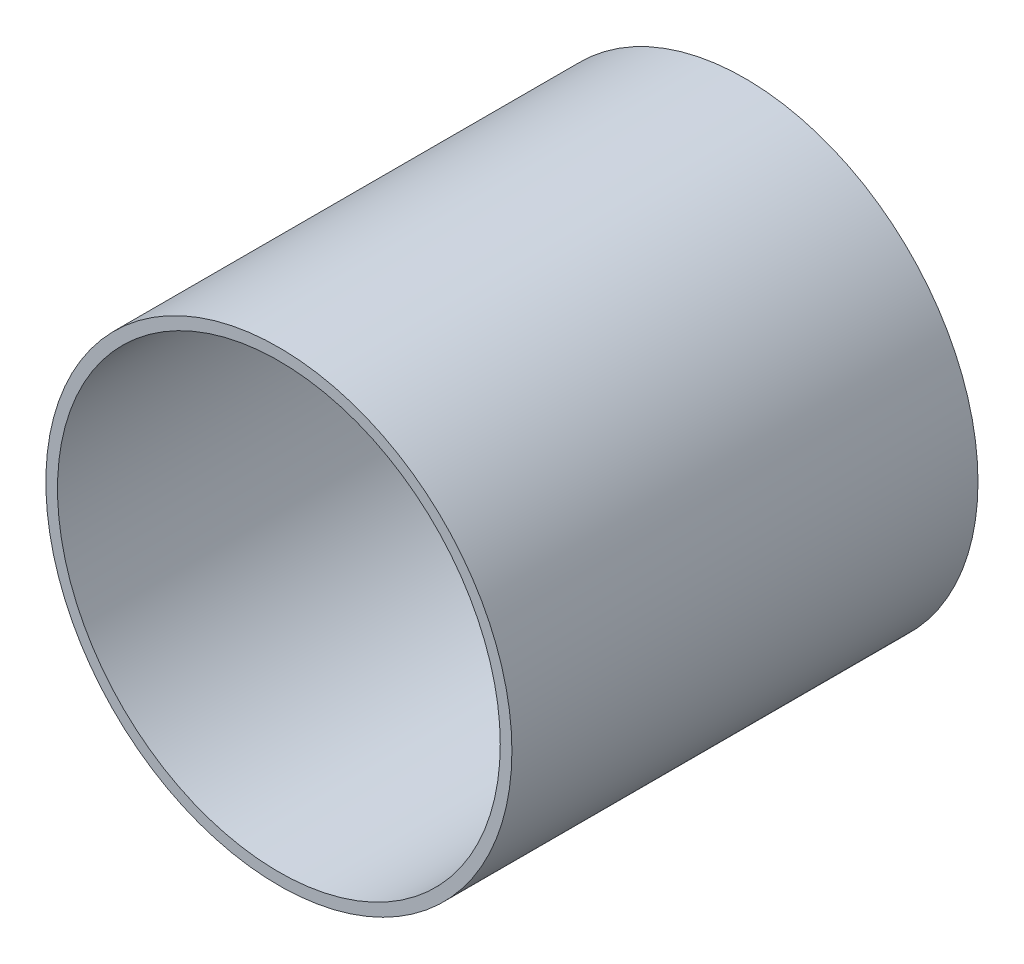
from build123d import *

# Parameters (mm, degrees)
SKETCH1_R           = 50.8
SKETCH1_R_2         = 48.26
BOSS_EXTRUDE1_DEPTH = 50.8


with BuildPart() as part:
    # Sketch1 → Boss-Extrude1 (new, symmetric)
    with BuildSketch(Plane.XY):
        Circle(SKETCH1_R)
        Circle(SKETCH1_R_2, mode=Mode.SUBTRACT)
    extrude(amount=BOSS_EXTRUDE1_DEPTH, both=True)


solid = part.part
